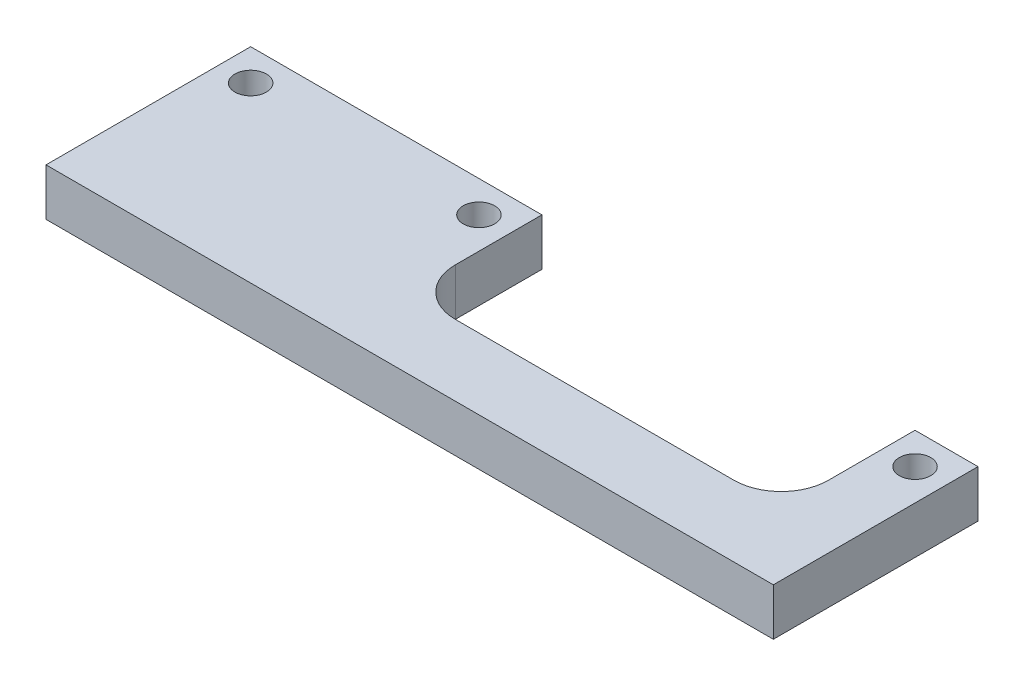
from build123d import *

# Parameters (mm, degrees)
SKETCH1_W           = 46.2
SKETCH1_H           = 13
BOSS_EXTRUDE1_DEPTH = 1.5
SKETCH3_R           = 1
CUT_EXTRUDE1_DEPTH  = 25.183878928
SKETCH4_W           = 23.7
SKETCH4_H           = 8.5
CUT_EXTRUDE2_DEPTH  = 25.183878928
FILLET1_R           = 3


with BuildPart() as part:
    # Sketch1 → Boss-Extrude1 (new, symmetric)
    with BuildSketch(Plane(origin=(0, 0, 0), x_dir=(1, 0, 0), z_dir=(0, 1, 0))):
        Rectangle(SKETCH1_W, SKETCH1_H)
    extrude(amount=BOSS_EXTRUDE1_DEPTH, both=True)

    # Sketch3 → Cut-Extrude1 (cut, through all)
    with BuildSketch(Plane(origin=(0, 1.5, 0), x_dir=(1, 0, 0), z_dir=(0, 1, 0))):
        with Locations(Location((-21.1, 4.5, 0), (0, 0, 270))):
            Circle(SKETCH3_R)
        with Locations(Location((-6.6, 4.5, 0), (0, 0, 270))):
            Circle(SKETCH3_R)
        with Locations(Location((21.1, 4.5, 0), (0, 0, 270))):
            Circle(SKETCH3_R)
    extrude(amount=-CUT_EXTRUDE1_DEPTH, mode=Mode.SUBTRACT)

    # Sketch4 → Cut-Extrude2 (cut, through all)
    with BuildSketch(Plane(origin=(0, 1.5, 0), x_dir=(1, 0, 0), z_dir=(0, 1, 0))):
        with Locations((7.25, 2.25)):
            Rectangle(SKETCH4_W, SKETCH4_H)
    extrude(amount=-CUT_EXTRUDE2_DEPTH, mode=Mode.SUBTRACT)

    # Fillet1
    fillet1_edges = [part.edges().sort_by_distance(p)[0] for p in [
        (-4.6, 0, 2),
        (19.1, 0, 2),
    ]]
    fillet(fillet1_edges, radius=FILLET1_R)


solid = part.part
